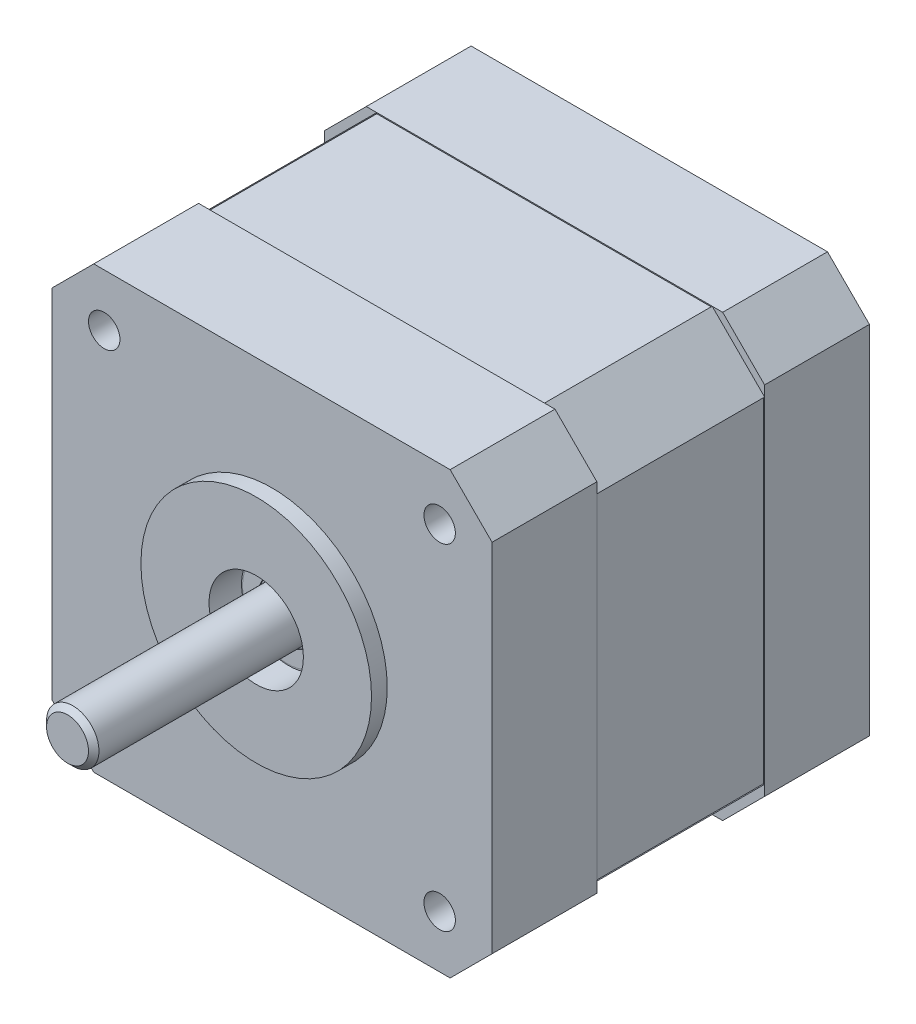
from build123d import *

# Parameters (mm, degrees)
SKETCH_1_R          = 4.5
SKETCH_1_R_2        = 3
EXTRUDE_1_DEPTH     = 10
EXTRUDE_2_DEPTH     = 16
SKETCH_3_R          = 1.5
EXTRUDE_3_DEPTH     = 10
SKETCH_5_W          = 16
SKETCH_5_H          = 32
CUT_EXTRUDE_1_DEPTH = 0.1
SKETCH_6_W          = 32
SKETCH_6_H          = 16
CUT_EXTRUDE_2_DEPTH = 0.1
SKETCH_7_W          = 16
SKETCH_7_H          = 32
CUT_EXTRUDE_3_DEPTH = 0.1
SKETCH_8_W          = 32
SKETCH_8_H          = 16
CUT_EXTRUDE_4_DEPTH = 0.1
SKETCH_9_R          = 1.5
CUT_EXTRUDE_5_DEPTH = 40.471508712
SKETCH_10_R         = 11
EXTRUDE_4_DEPTH     = 1.5
CUT_EXTRUDE_START   = -3
SKETCH_11_R         = 4.5
CUT_EXTRUDE_6_DEPTH = 3
SKETCH_12_R         = 4
EXTRUDE_5_DEPTH     = 9
CHAMFER_1_SIZE      = 1
SKETCH_13_R         = 2.5
EXTRUDE_6_DEPTH     = 21
CUT_EXTRUDE_START_2 = -0.1
SKETCH_14_R         = 2.8
SKETCH_14_R_2       = 2.5
CUT_EXTRUDE_7_DEPTH = 0.1
SKETCH_15_R         = 4.5
SKETCH_15_R_2       = 4.3
CUT_EXTRUDE_8_DEPTH = 0.1
CHAMFER_2_SIZE      = 0.5


with BuildPart() as part:
    # 草图1 → 凸台-拉伸1 (new body)
    with BuildSketch(Plane.XY):
        Polygon((-21, 17), (-17, 21), (17, 21), (21, 17), (21, -17), (17, -21), (-17, -21), (-21, -17), align=None)
        Circle(SKETCH_1_R, mode=Mode.SUBTRACT)
        with Locations((-16, 16)):
            Circle(SKETCH_1_R_2, mode=Mode.SUBTRACT)
        with Locations(Location((16, 16, 0), (0, 0, 180))):
            Circle(SKETCH_1_R_2, mode=Mode.SUBTRACT)
        with Locations((16, -16)):
            Circle(SKETCH_1_R_2, mode=Mode.SUBTRACT)
        with Locations(Location((-16, -16, 0), (0, 0, 180))):
            Circle(SKETCH_1_R_2, mode=Mode.SUBTRACT)
    extrude(amount=EXTRUDE_1_DEPTH)

    # 草图2 → 凸台-拉伸2 (add)
    with BuildSketch(Plane.XY.offset(10)):
        Polygon((16, 21), (-16, 21), (-21, 16), (-21, -16), (-16, -21), (16, -21), (21, -16), (21, 16), align=None)
    extrude(amount=EXTRUDE_2_DEPTH)

    # 草图3 → 凸台-拉伸3 (add)
    with BuildSketch(Plane.XY.offset(26)):
        Polygon((-17, 21), (-21, 17), (-21, 16), (-21, -16), (-21, -17), (-17, -21), (-16, -21), (16, -21), (17, -21), (21, -17), (21, -16), (21, 16), (21, 17), (17, 21), (16, 21), (-16, 21), align=None)
        with Locations((-16, 16)):
            Circle(SKETCH_3_R, mode=Mode.SUBTRACT)
        with Locations(Location((16, 16, 0), (0, 0, 180))):
            Circle(SKETCH_3_R, mode=Mode.SUBTRACT)
        with Locations((16, -16)):
            Circle(SKETCH_3_R, mode=Mode.SUBTRACT)
        with Locations(Location((-16, -16, 0), (0, 0, 180))):
            Circle(SKETCH_3_R, mode=Mode.SUBTRACT)
    extrude(amount=EXTRUDE_3_DEPTH)

    # 草图5 → 切除-拉伸1 (cut)
    with BuildSketch(Plane.ZY.offset(21)):
        with Locations((18, 0)):
            Rectangle(SKETCH_5_W, SKETCH_5_H)
    extrude(amount=-CUT_EXTRUDE_1_DEPTH, mode=Mode.SUBTRACT)

    # 草图6 → 切除-拉伸2 (cut)
    with BuildSketch(Plane(origin=(0, 21, 0), x_dir=(1, 0, 0), z_dir=(0, 1, 0))):
        with Locations((0, -18)):
            Rectangle(SKETCH_6_W, SKETCH_6_H)
    extrude(amount=-CUT_EXTRUDE_2_DEPTH, mode=Mode.SUBTRACT)

    # 草图7 → 切除-拉伸3 (cut)
    with BuildSketch(Plane(origin=(21, 0, 0), x_dir=(0, 0, -1), z_dir=(1, 0, 0))):
        with Locations((-18, 0)):
            Rectangle(SKETCH_7_W, SKETCH_7_H)
    extrude(amount=-CUT_EXTRUDE_3_DEPTH, mode=Mode.SUBTRACT)

    # 草图8 → 切除-拉伸4 (cut)
    with BuildSketch(Plane.XZ.offset(21)):
        with Locations((0, 18)):
            Rectangle(SKETCH_8_W, SKETCH_8_H)
    extrude(amount=-CUT_EXTRUDE_4_DEPTH, mode=Mode.SUBTRACT)

    # 草图9 → 切除-拉伸5 (cut, through all)
    with BuildSketch(Plane.XY.offset(26)):
        with Locations(Location((-16, -16, 0), (0, 0, 180))):
            Circle(SKETCH_9_R)
        with Locations((-16, 16)):
            Circle(SKETCH_9_R)
        with Locations(Location((16, 16, 0), (0, 0, 180))):
            Circle(SKETCH_9_R)
        with Locations((16, -16)):
            Circle(SKETCH_9_R)
    extrude(amount=-CUT_EXTRUDE_5_DEPTH, mode=Mode.SUBTRACT)

    # 草图10 → 凸台-拉伸4 (add)
    with BuildSketch(Plane.XY.offset(36)):
        Circle(SKETCH_10_R)
    extrude(amount=EXTRUDE_4_DEPTH)

    # 草图11 → 切除-拉伸6 (cut)
    with BuildSketch(Plane.XY.offset(37.5).offset(CUT_EXTRUDE_START)):
        Circle(SKETCH_11_R)
    extrude(amount=CUT_EXTRUDE_6_DEPTH, mode=Mode.SUBTRACT)

    # 草图12 → 凸台-拉伸5 (add)
    with BuildSketch(Plane(origin=(0, 0, 10), x_dir=(-1, 0, 0), z_dir=(0, 0, -1))):
        with Locations(Location((0, 0, 0), (0, 0, 180))):
            Circle(SKETCH_12_R)
    extrude(amount=EXTRUDE_5_DEPTH)

    # 倒角1
    chamfer_1_edges = [part.edges().sort_by_distance(p)[0] for p in [
        (-4, 0, 1),
    ]]
    chamfer(chamfer_1_edges, length=CHAMFER_1_SIZE)

    # 草图13 → 凸台-拉伸6 (add)
    with BuildSketch(Plane.XY.offset(34.5)):
        with Locations(Location((0, 0, 0), (0, 0, 180))):
            Circle(SKETCH_13_R)
    extrude(amount=EXTRUDE_6_DEPTH)

    # 草图14 → 切除-拉伸7 (cut)
    with BuildSketch(Plane.XY.offset(34.5).offset(CUT_EXTRUDE_START_2)):
        Circle(SKETCH_14_R)
        with Locations(Location((0, 0, 0), (0, 0, 180))):
            Circle(SKETCH_14_R_2, mode=Mode.SUBTRACT)
    extrude(amount=CUT_EXTRUDE_7_DEPTH, mode=Mode.SUBTRACT)

    # 草图15 → 切除-拉伸8 (cut)
    with BuildSketch(Plane.XY.offset(34.5).offset(CUT_EXTRUDE_START_2)):
        Circle(SKETCH_15_R)
        Circle(SKETCH_15_R_2, mode=Mode.SUBTRACT)
    extrude(amount=CUT_EXTRUDE_8_DEPTH, mode=Mode.SUBTRACT)

    # 倒角2
    chamfer_2_edges = [part.edges().sort_by_distance(p)[0] for p in [
        (2.5, 0, 55.5),
    ]]
    chamfer(chamfer_2_edges, length=CHAMFER_2_SIZE)


solid = part.part
